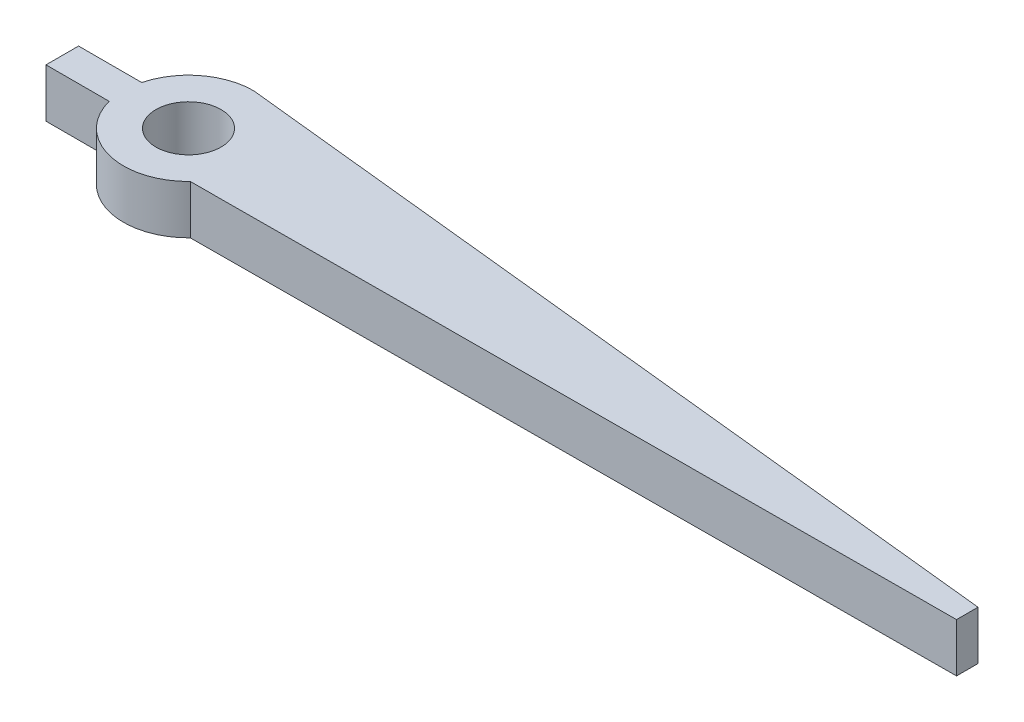
from build123d import *

# Parameters (mm, degrees)
SKETCH1_R           = 1
BOSS_EXTRUDE1_DEPTH = 1.5


with BuildPart() as part:
    # Sketch1 → Boss-Extrude1 (new body)
    # profile 1 of 3: a face of its own
    with BuildSketch(Plane(origin=(0, 0, 0), x_dir=(1, 0, 0), z_dir=(0, 1, 0))):
        with BuildLine():
            ThreePointArc((-38.479582276, 15.672906391), (-38.624558781, 14.925318383), (-39.038470107, 14.28611307))
            Line((-39.038470107, 14.28611307), (-15.616534892, 14.400685258))
            Line((-15.616534892, 14.400685258), (-15.616534892, 15.05969481))
            Line((-15.616534892, 15.05969481), (-40.063758895, 17.629201593))
            ThreePointArc((-40.063758895, 17.629201593), (-38.925290354, 16.931547173), (-38.479582276, 15.672906391))
        make_face()
    # profile 2 of 3: a face of its own
    with BuildSketch(Plane(origin=(0, 0, 0), x_dir=(1, 0, 0), z_dir=(0, 1, 0))):
        with BuildLine():
            ThreePointArc((-40.479582276, 17.672906391), (-41.704327148, 17.254045221), (-42.41607395, 16.172906391))
            ThreePointArc((-42.41607395, 16.172906391), (-42.479582276, 15.672906391), (-42.41607395, 15.172906391))
            ThreePointArc((-42.41607395, 15.172906391), (-40.987470858, 13.738468698), (-39.038470107, 14.28611307))
            ThreePointArc((-39.038470107, 14.28611307), (-38.624558781, 14.925318383), (-38.479582276, 15.672906391))
            ThreePointArc((-38.479582276, 15.672906391), (-38.925290354, 16.931547173), (-40.063758895, 17.629201593))
            Line((-40.063758895, 17.629201593), (-40.479582276, 17.672906391))
        make_face()
        with Locations(Location((-40.479582276, 15.672906391, 0), (0, 0, 270))):
            Circle(SKETCH1_R, mode=Mode.SUBTRACT)
    # profile 3 of 3: a face of its own
    with BuildSketch(Plane(origin=(0, 0, 0), x_dir=(1, 0, 0), z_dir=(0, 1, 0))):
        with BuildLine():
            Line((-42.41607395, 16.172906391), (-44.35607395, 16.172906391))
            Line((-44.35607395, 16.172906391), (-44.35607395, 15.172906391))
            Line((-44.35607395, 15.172906391), (-42.41607395, 15.172906391))
            ThreePointArc((-42.41607395, 15.172906391), (-42.479582276, 15.672906391), (-42.41607395, 16.172906391))
        make_face()
    extrude(amount=BOSS_EXTRUDE1_DEPTH)


solid = part.part
